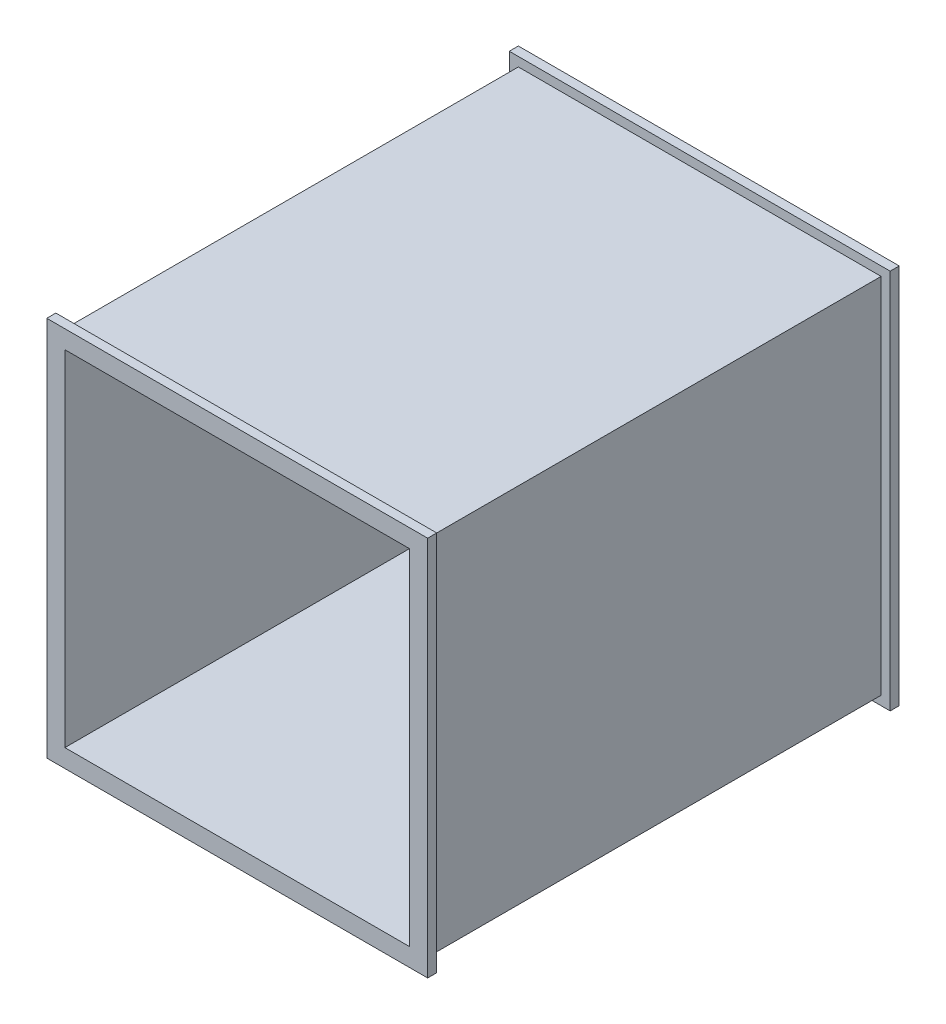
from build123d import *

# Parameters (mm, degrees)
SKETCH1_W           = 200
SKETCH1_H           = 200
BOSS_EXTRUDE1_DEPTH = 250
SKETCH2_W           = 210
SKETCH2_H           = 210
BOSS_EXTRUDE2_DEPTH = 5
SKETCH3_W           = 210
SKETCH3_H           = 210
BOSS_EXTRUDE3_DEPTH = 5
SKETCH4_W           = 190
SKETCH4_H           = 190
CUT_EXTRUDE1_DEPTH  = 300.416098432


with BuildPart() as part:
    # Sketch1 → Boss-Extrude1 (new body)
    with BuildSketch(Plane.XY):
        Rectangle(SKETCH1_W, SKETCH1_H)
    extrude(amount=BOSS_EXTRUDE1_DEPTH)

    # Sketch2 → Boss-Extrude2 (add)
    with BuildSketch(Plane.XY.offset(250)):
        Rectangle(SKETCH2_W, SKETCH2_H)
    extrude(amount=BOSS_EXTRUDE2_DEPTH)

    # Sketch3 → Boss-Extrude3 (add)
    with BuildSketch(Plane(origin=(0, 0, 0), x_dir=(-1, 0, 0), z_dir=(0, 0, -1))):
        Rectangle(SKETCH3_W, SKETCH3_H)
    extrude(amount=BOSS_EXTRUDE3_DEPTH)

    # Sketch4 → Cut-Extrude1 (cut, through all)
    with BuildSketch(Plane.XY.offset(255)):
        Rectangle(SKETCH4_W, SKETCH4_H)
    extrude(amount=-CUT_EXTRUDE1_DEPTH, mode=Mode.SUBTRACT)


solid = part.part
